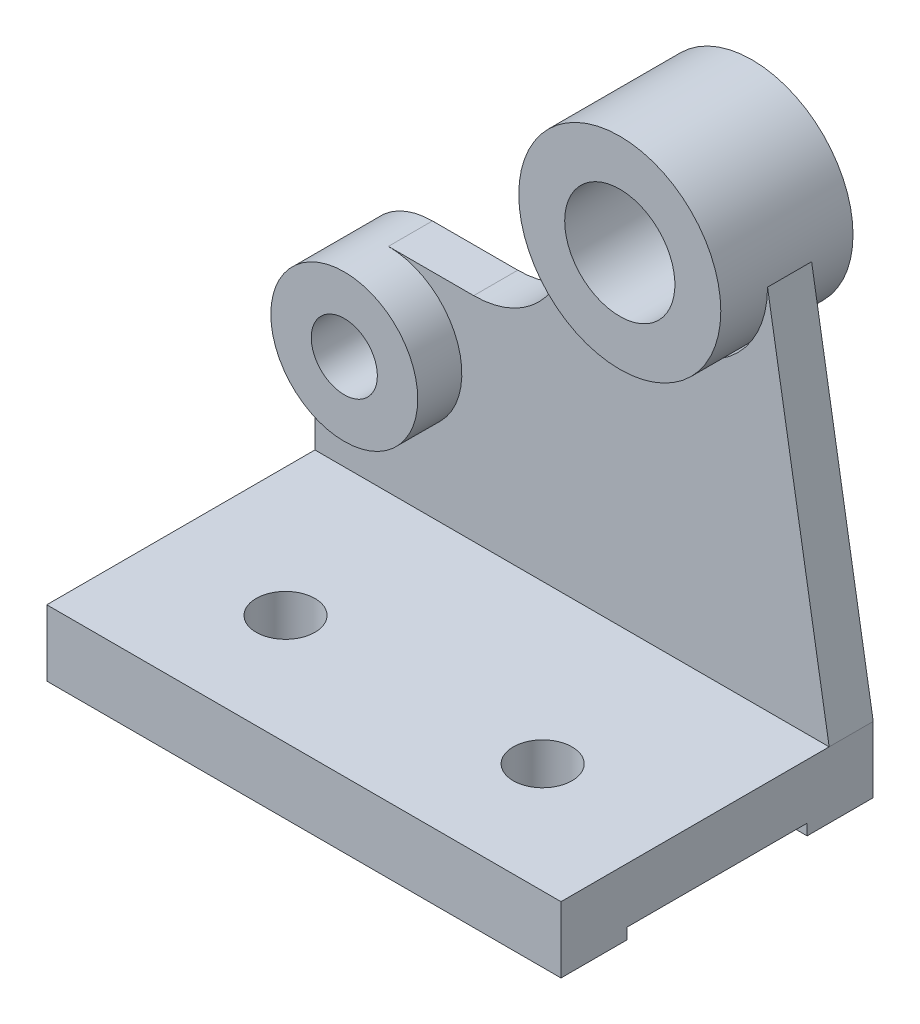
from build123d import *

# Parameters (mm, degrees)
BOSS_EXTRUDE1_DEPTH = 12
SKETCH1_3_R         = 9
BOSS_EXTRUDE2_DEPTH = 24
SKETCH1_4_W         = 140
SKETCH1_4_H         = 18
BOSS_EXTRUDE3_DEPTH = 85
SKETCH2_R           = 27.5
SKETCH2_R_2         = 15
BOSS_EXTRUDE4_DEPTH = 18
SKETCH3_R           = 8
CUT_EXTRUDE1_DEPTH  = 208.560232222
SKETCH5_W           = 49
SKETCH5_H           = 3
CUT_EXTRUDE2_DEPTH  = 220.078182392


with BuildPart() as part:
    # Sketch1 → Boss-Extrude1 (new body)
    with BuildSketch(Plane.XY):
        with BuildLine():
            Line((140, 18), (123.22800697, 118))
            ThreePointArc((123.22800697, 118), (95.72800697, 90.5), (68.22800697, 118))
            Line((68.22800697, 118), (68.22800697, 101))
            ThreePointArc((68.22800697, 101), (60.9056765, 83.32233047), (43.22800697, 76))
            Line((43.22800697, 76), (20, 76))
            ThreePointArc((20, 76), (34.142135624, 70.142135624), (40, 56))
            ThreePointArc((40, 56), (20, 36), (0, 56))
            Line((0, 56), (0, 18))
            Line((0, 18), (140, 18))
        make_face()
    extrude(amount=BOSS_EXTRUDE1_DEPTH)

    # Sketch1<3> → Boss-Extrude2 (add)
    with BuildSketch(Plane.XY):
        with BuildLine():
            ThreePointArc((20, 76), (5.857864376, 70.142135624), (0, 56))
            ThreePointArc((0, 56), (20, 36), (40, 56))
            ThreePointArc((40, 56), (34.142135624, 70.142135624), (20, 76))
        make_face()
        with Locations((20, 56)):
            Circle(SKETCH1_3_R, mode=Mode.SUBTRACT)
    extrude(amount=BOSS_EXTRUDE2_DEPTH)

    # Sketch1<4> → Boss-Extrude3 (add)
    with BuildSketch(Plane.XY):
        with Locations((70, 9)):
            Rectangle(SKETCH1_4_W, SKETCH1_4_H)
    extrude(amount=BOSS_EXTRUDE3_DEPTH)

    # Sketch2 → Boss-Extrude4 (add, symmetric)
    with BuildSketch(Plane(origin=(0, 0, 6), x_dir=(-1, 0, 0), z_dir=(0, 0, -1))):
        with Locations((-95, 118)):
            Circle(SKETCH2_R)
        with Locations((-95, 118)):
            Circle(SKETCH2_R_2, mode=Mode.SUBTRACT)
    extrude(amount=BOSS_EXTRUDE4_DEPTH, both=True)

    # Sketch3 → Cut-Extrude1 (cut, through all)
    with BuildSketch(Plane(origin=(0, 18, 0), x_dir=(1, 0, 0), z_dir=(0, 1, 0))):
        with Locations((105, -55)):
            Circle(SKETCH3_R)
        with Locations((35, -55)):
            Circle(SKETCH3_R)
    extrude(amount=-CUT_EXTRUDE1_DEPTH, mode=Mode.SUBTRACT)

    # Sketch5 → Cut-Extrude2 (cut, through all)
    with BuildSketch(Plane.ZY):
        with Locations((42.5, 1.5)):
            Rectangle(SKETCH5_W, SKETCH5_H)
    extrude(amount=-CUT_EXTRUDE2_DEPTH, mode=Mode.SUBTRACT)


solid = part.part
